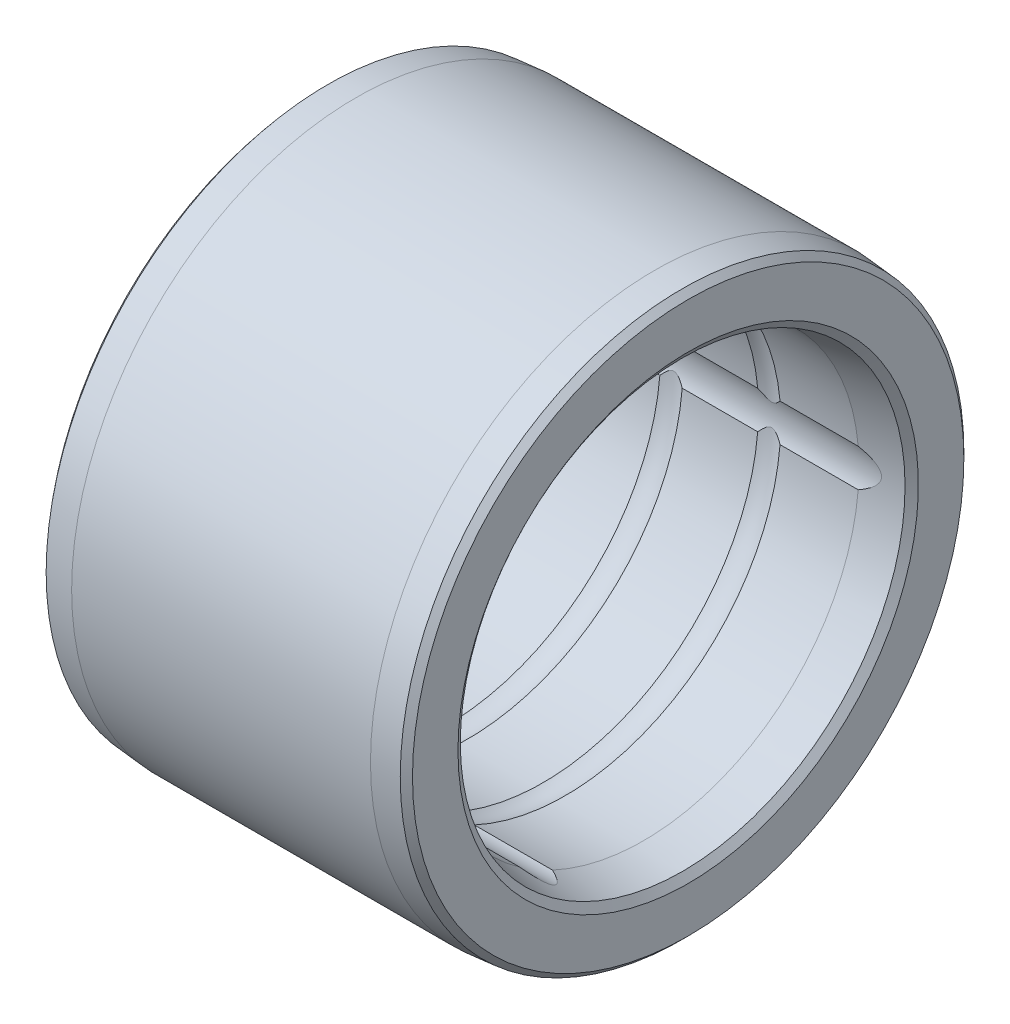
from build123d import *
from OCP.BRepFilletAPI import BRepFilletAPI_MakeChamfer

# Parameters (mm, degrees)
ID_CHAMFER_SIZE   = 0.25
ID_CHAMFER_SIZE2  = 0.307635462
OD_CHAMFER_SIZE   = 0.25
OD_CHAMFER_SIZE2  = 0.275015717
BORE_SLOT_DEPTH   = 25.334248499
CIRPATTERN1_COUNT = 3


with BuildPart() as part:
    # Sketch1 → Revolve1 (revolve)
    with BuildSketch(Plane.XY, mode=Mode.PRIVATE) as revolve1_sk:
        with BuildLine():
            Line((0, 10), (0, 12.593767005))
            Line((0, 12.593767005), (1.5, 12.725))
            Line((1.5, 12.725), (14.88, 12.725))
            Line((14.88, 12.725), (16.38, 12.593767005))
            Line((16.38, 12.593767005), (16.38, 10))
            Line((16.38, 10), (14.38, 9.65))
            Line((14.38, 9.65), (10.88, 9.65))
            ThreePointArc((10.88, 9.65), (10.38, 9.75), (9.88, 9.65))
            Line((9.88, 9.65), (6.5, 9.65))
            ThreePointArc((6.5, 9.65), (6, 9.75), (5.5, 9.65))
            Line((5.5, 9.65), (2, 9.65))
            Line((2, 9.65), (0, 10))
        make_face()
    revolve(revolve1_sk.sketch.rotate(Axis((-2.430533636, 0, 0), (1, 0, 0)), 90), axis=Axis((-2.430533636, 0, 0), (1, 0, 0)))

    # ID Chamfer: one chamfer whose edges measure the first distance from different faces: ONE call of the kernel's chamfer builder (chamfer() names one face for all edges)
    id_chamfer_edges_1 = [part.edges().sort_by_distance(p)[0] for p in [
        (16.38, 0, -10),
    ]]
    id_chamfer_side_1 = [part.faces().sort_by_distance(p)[0] for p in [
        (15.38, 0, -9.825),
    ]]
    id_chamfer_edges_2 = [part.edges().sort_by_distance(p)[0] for p in [
        (0, 0, -10),
    ]]
    id_chamfer_side_2 = [part.faces().sort_by_distance(p)[0] for p in [
        (0, 0, -10.356205522),
    ]]
    id_chamfer = BRepFilletAPI_MakeChamfer(part.part.solid().wrapped)
    for e in id_chamfer_edges_1:
        id_chamfer.Add(ID_CHAMFER_SIZE, ID_CHAMFER_SIZE2, e.wrapped, id_chamfer_side_1[0].wrapped)  # the first distance lies on this face
    for e in id_chamfer_edges_2:
        id_chamfer.Add(ID_CHAMFER_SIZE, ID_CHAMFER_SIZE2, e.wrapped, id_chamfer_side_2[0].wrapped)  # the first distance lies on this face
    add(Compound.cast(id_chamfer.Shape()), mode=Mode.REPLACE)

    # OD Chamfer: one chamfer whose edges measure the first distance from different faces: ONE call of the kernel's chamfer builder (chamfer() names one face for all edges)
    od_chamfer_edges_1 = [part.edges().sort_by_distance(p)[0] for p in [
        (16.38, 0, -12.593767005),
    ]]
    od_chamfer_side_1 = [part.faces().sort_by_distance(p)[0] for p in [
        (16.38, 0, -10.663840984),
    ]]
    od_chamfer_edges_2 = [part.edges().sort_by_distance(p)[0] for p in [
        (0, 0, -12.593767005),
    ]]
    od_chamfer_side_2 = [part.faces().sort_by_distance(p)[0] for p in [
        (0.75, 0, -12.659383502),
    ]]
    od_chamfer = BRepFilletAPI_MakeChamfer(part.part.solid().wrapped)
    for e in od_chamfer_edges_1:
        od_chamfer.Add(OD_CHAMFER_SIZE, OD_CHAMFER_SIZE2, e.wrapped, od_chamfer_side_1[0].wrapped)  # the first distance lies on this face
    for e in od_chamfer_edges_2:
        od_chamfer.Add(OD_CHAMFER_SIZE, OD_CHAMFER_SIZE2, e.wrapped, od_chamfer_side_2[0].wrapped)  # the first distance lies on this face
    add(Compound.cast(od_chamfer.Shape()), mode=Mode.REPLACE)

    # Sketch2 → Bore Slot (cut, through all)
    with BuildSketch(Plane(origin=(0, 0, 0), x_dir=(0, 0, -1), z_dir=(1, 0, 0))):
        with BuildLine():
            ThreePointArc((-4.075172705, 8.747312011), (-4.9, 8.487048957), (-5.537808064, 7.902859093))
            ThreePointArc((-5.537808064, 7.902859093), (-4.825, 8.357145147), (-4.075172705, 8.747312011))
        make_face()
    bore_slot = extrude(amount=BORE_SLOT_DEPTH, mode=Mode.SUBTRACT)

    # CirPattern1: Bore Slot ×3 about axis
    cirpattern1_axis = Axis((0, 0, 0), (1, 0, 0))
    for i in range(1, CIRPATTERN1_COUNT):
        add(bore_slot.rotate(cirpattern1_axis, i * 360 / CIRPATTERN1_COUNT), mode=Mode.SUBTRACT)


solid = part.part
